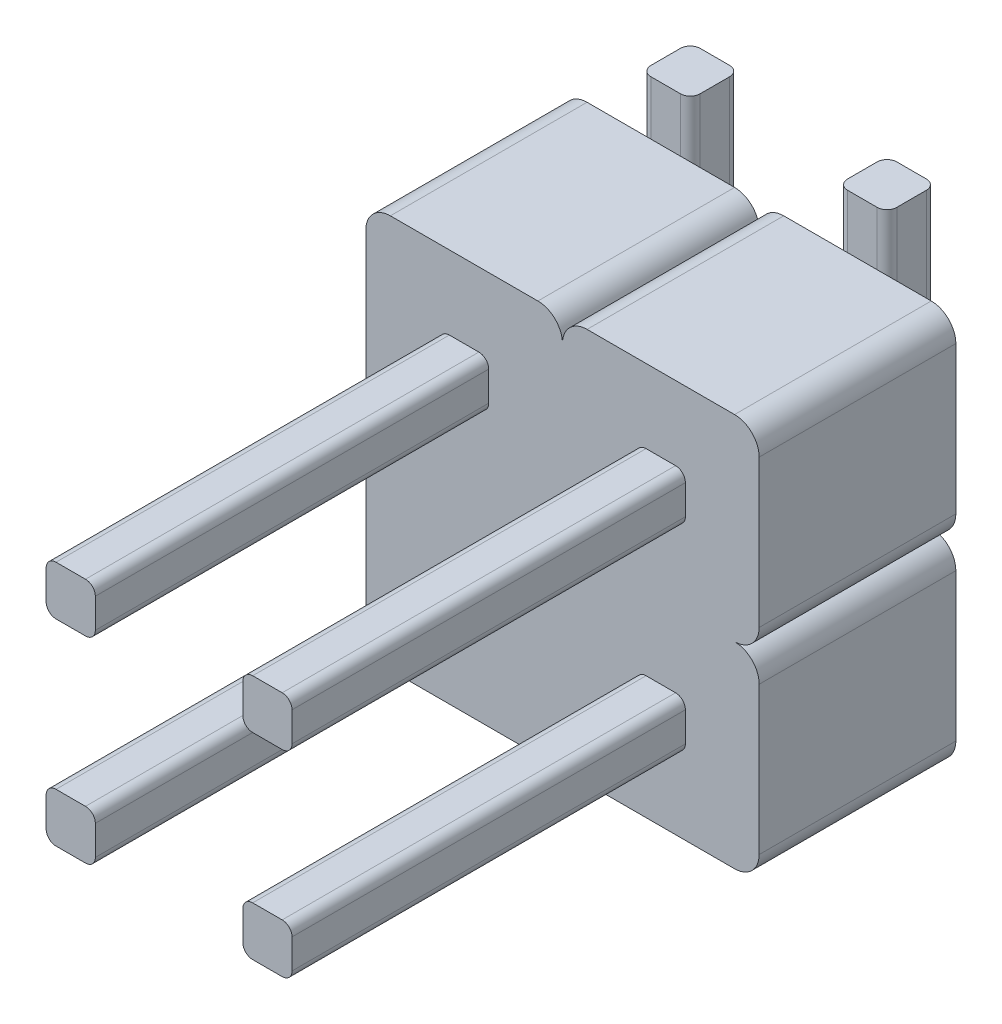
from build123d import *

# Parameters (mm, degrees)
EXTRUDE_1_DEPTH             = 2
EXTRUDE_START               = -2
EXTRUDE_2_DEPTH             = 6
PATTERN_LINEAR_2_COUNT      = 2
PATTERN_LINEAR_2_PITCH      = 2
PATTERN_LINEAR_2_COUNT_DIR2 = 2
PATTERN_LINEAR_2_PITCH_DIR2 = 2
PATTERN_LINEAR_10_COUNT     = 2
PATTERN_LINEAR_10_PITCH     = 2


with BuildPart() as part:
    # 草图1 → 凸台-拉伸1 (new body)
    with BuildSketch(Plane.XY):
        with BuildLine():
            Line((0.25, 0), (1.75, 0))
            ThreePointArc((1.75, 0), (1.926776695, -0.073223305), (2, -0.25))
            Line((2, -0.25), (2, -1.75))
            ThreePointArc((2, -1.75), (1.926776695, -1.926776695), (1.75, -2))
            Line((1.75, -2), (0.25, -2))
            ThreePointArc((0.25, -2), (0.073223305, -1.926776695), (0, -1.75))
            Line((0, -1.75), (0, -0.25))
            ThreePointArc((0, -0.25), (0.073223305, -0.073223305), (0.25, 0))
        make_face()
        with BuildLine():
            Line((0.85, -0.75), (1.15, -0.75))
            ThreePointArc((1.15, -0.75), (1.220710678, -0.779289322), (1.25, -0.85))
            Line((1.25, -0.85), (1.25, -1.15))
            ThreePointArc((1.25, -1.15), (1.220710678, -1.220710678), (1.15, -1.25))
            Line((1.15, -1.25), (0.85, -1.25))
            ThreePointArc((0.85, -1.25), (0.779289322, -1.220710678), (0.75, -1.15))
            Line((0.75, -1.15), (0.75, -0.85))
            ThreePointArc((0.75, -0.85), (0.779289322, -0.779289322), (0.85, -0.75))
        make_face(mode=Mode.SUBTRACT)
    extrude_1 = extrude(amount=EXTRUDE_1_DEPTH)

    # 草图2 → 凸台-拉伸2 (add)
    with BuildSketch(Plane.XY.offset(2).offset(EXTRUDE_START)):
        with BuildLine():
            Line((0.75, -0.85), (0.75, -1.15))
            ThreePointArc((0.75, -1.15), (0.779289322, -1.220710678), (0.85, -1.25))
            Line((0.85, -1.25), (1.15, -1.25))
            ThreePointArc((1.15, -1.25), (1.220710678, -1.220710678), (1.25, -1.15))
            Line((1.25, -1.15), (1.25, -0.85))
            ThreePointArc((1.25, -0.85), (1.220710678, -0.779289322), (1.15, -0.75))
            Line((1.15, -0.75), (0.85, -0.75))
            ThreePointArc((0.85, -0.75), (0.779289322, -0.779289322), (0.75, -0.85))
        make_face()
    extrude_2 = extrude(amount=EXTRUDE_2_DEPTH)

    # 阵列(线性)2: 凸台-拉伸1, Extrude 2 2 × 2
    with Locations(*[(i * PATTERN_LINEAR_2_PITCH, -j * PATTERN_LINEAR_2_PITCH_DIR2, 0) for i in range(PATTERN_LINEAR_2_COUNT) for j in range(PATTERN_LINEAR_2_COUNT_DIR2) if (i, j) != (0, 0)]):
        add(extrude_1)
        add(extrude_2)

    # 扫描2: sweep along a path in 草图4
    with BuildLine(Plane.ZY.offset(-1)) as sweep_2_path:
        Line((0, -1.250284889), (-0.45, -1.250284889))
        ThreePointArc((-0.45, -1.250284889), (-0.520710678, -1.220995567), (-0.55, -1.150284889))
        Line((-0.55, -1.150284889), (-0.55, 0.5))
    # 草图3 → 扫描2 (sweep)
    with BuildSketch(Plane(origin=(0, 0, 0), x_dir=(-1, 0, 0), z_dir=(0, 0, -1))):
        with BuildLine():
            Line((-0.75, -0.85), (-0.75, -1.15))
            ThreePointArc((-0.75, -1.15), (-0.779289322, -1.220710678), (-0.85, -1.25))
            Line((-0.85, -1.25), (-1.15, -1.25))
            ThreePointArc((-1.15, -1.25), (-1.220710678, -1.220710678), (-1.25, -1.15))
            Line((-1.25, -1.15), (-1.25, -0.85))
            ThreePointArc((-1.25, -0.85), (-1.220710678, -0.779289322), (-1.15, -0.75))
            Line((-1.15, -0.75), (-0.85, -0.75))
            ThreePointArc((-0.85, -0.75), (-0.779289322, -0.779289322), (-0.75, -0.85))
        make_face()
    sweep_2 = sweep(path=sweep_2_path.line)

    # 镜向5: 扫描2 across plane
    add(sweep_2.mirror(Plane(origin=(0, -2, 0), x_dir=(0, 0, 1), z_dir=(0, -1, 0))))

    # 阵列(线性)10: 扫描2 ×2
    with Locations(*[(i * PATTERN_LINEAR_10_PITCH, 0, 0) for i in range(1, PATTERN_LINEAR_10_COUNT)]):
        add(sweep_2)

    # 阵列(线性)10 copy 1: sweep along a path in 阵列(线性)10 copy 1 path
    with BuildLine(Plane(origin=(3, -4, 0), x_dir=(0, 0, 1), z_dir=(-1, 0, 0))) as pattern_linear_10_copy_1_path:
        Line((0, 1.250284889), (-0.45, 1.250284889))
        ThreePointArc((-0.45, 1.250284889), (-0.520710678, 1.220995567), (-0.55, 1.150284889))
        Line((-0.55, 1.150284889), (-0.55, -0.5))
    # 阵列(线性)10 copy 1 sketch → 阵列(线性)10 copy 1 (sweep)
    with BuildSketch(Plane(origin=(2, -4, 0), x_dir=(-1, 0, 0), z_dir=(0, 0, -1))):
        with BuildLine():
            Line((-0.75, 0.85), (-0.75, 1.15))
            ThreePointArc((-0.75, 1.15), (-0.779289322, 1.220710678), (-0.85, 1.25))
            Line((-0.85, 1.25), (-1.15, 1.25))
            ThreePointArc((-1.15, 1.25), (-1.220710678, 1.220710678), (-1.25, 1.15))
            Line((-1.25, 1.15), (-1.25, 0.85))
            ThreePointArc((-1.25, 0.85), (-1.220710678, 0.779289322), (-1.15, 0.75))
            Line((-1.15, 0.75), (-0.85, 0.75))
            ThreePointArc((-0.85, 0.75), (-0.779289322, 0.779289322), (-0.75, 0.85))
        make_face()
    sweep(path=pattern_linear_10_copy_1_path.line)


solid = part.part
